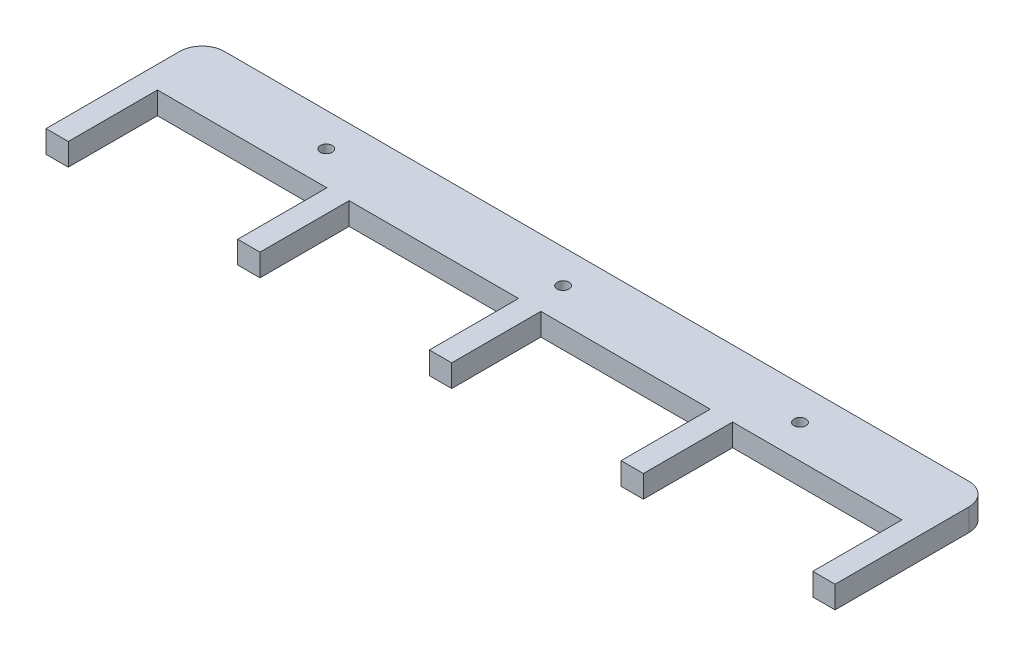
from build123d import *

# Parameters (mm, degrees)
SKETCH1_R           = 1.7
BOSS_EXTRUDE1_DEPTH = 6.35


with BuildPart() as part:
    # Sketch1 → Boss-Extrude1 (new body)
    with BuildSketch(Plane(origin=(0, 0, 0), x_dir=(1, 0, 0), z_dir=(0, 1, 0))):
        with BuildLine():
            Line((-131.683125, 82.55), (-131.683125, 44.45))
            Line((-131.683125, 44.45), (-125.333125, 44.45))
            Line((-125.333125, 44.45), (-125.333125, 69.85))
            Line((-125.333125, 69.85), (-77.073125, 69.85))
            Line((-77.073125, 69.85), (-77.073125, 44.45))
            Line((-77.073125, 44.45), (-70.723125, 44.45))
            Line((-70.723125, 44.45), (-70.723125, 69.85))
            Line((-70.723125, 69.85), (-22.463125, 69.85))
            Line((-22.463125, 69.85), (-22.463125, 44.45))
            Line((-22.463125, 44.45), (-16.113125, 44.45))
            Line((-16.113125, 44.45), (-16.113125, 69.85))
            Line((-16.113125, 69.85), (32.146875, 69.85))
            Line((32.146875, 69.85), (32.146875, 44.45))
            Line((32.146875, 44.45), (38.496875, 44.45))
            Line((38.496875, 44.45), (38.496875, 69.85))
            Line((38.496875, 69.85), (86.756875, 69.85))
            Line((86.756875, 69.85), (86.756875, 44.45))
            Line((86.756875, 44.45), (93.106875, 44.45))
            Line((93.106875, 44.45), (93.106875, 82.55))
            ThreePointArc((93.106875, 82.55), (91.247003061, 87.040128061), (86.756875, 88.9))
            Line((86.756875, 88.9), (-125.333125, 88.9))
            ThreePointArc((-125.333125, 88.9), (-129.823253061, 87.040128061), (-131.683125, 82.55))
        make_face()
        with Locations(Location((-86.756875, 79.375, 0), (0, 0, 270))):
            Circle(SKETCH1_R, mode=Mode.SUBTRACT)
        with Locations(Location((-19.288125, 79.375, 0), (0, 0, 270))):
            Circle(SKETCH1_R, mode=Mode.SUBTRACT)
        with Locations(Location((48.180625, 79.375, 0), (0, 0, 270))):
            Circle(SKETCH1_R, mode=Mode.SUBTRACT)
    extrude(amount=BOSS_EXTRUDE1_DEPTH)


solid = part.part
